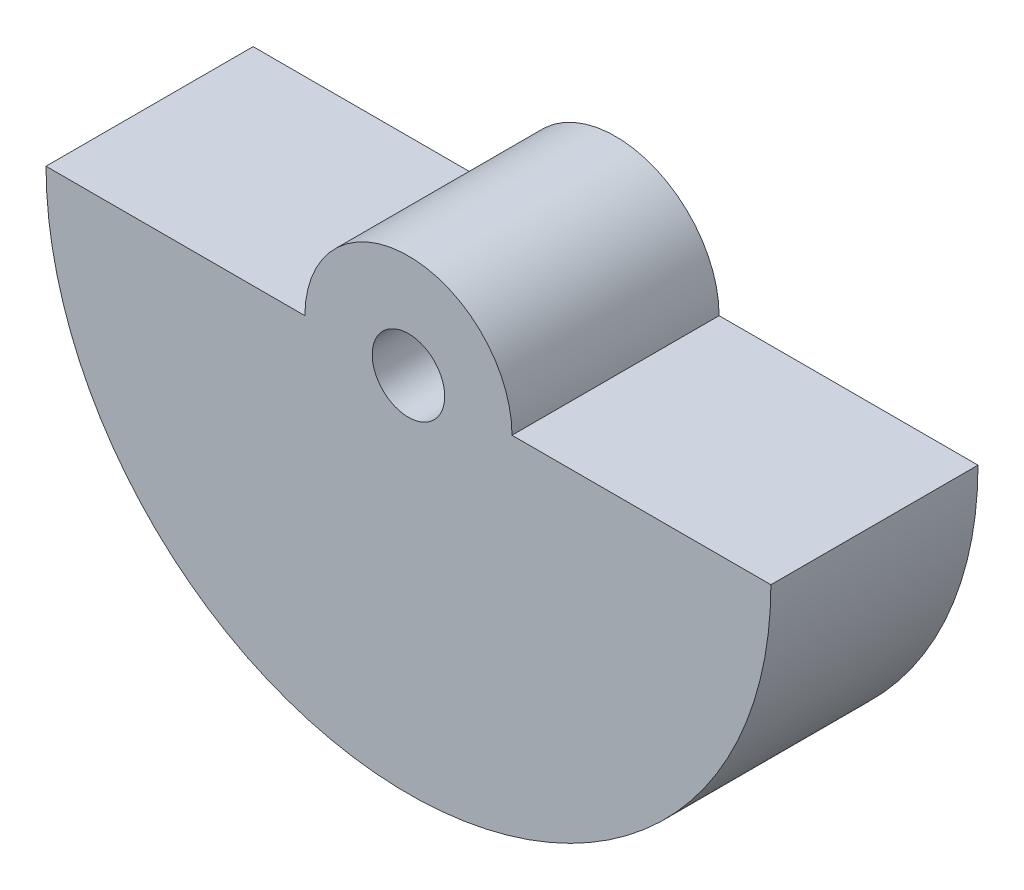
from build123d import *

# Parameters (mm, degrees)
SKETCH1_R           = 3.5
BOSS_EXTRUDE1_DEPTH = 20


with BuildPart() as part:
    # Sketch1 → Boss-Extrude1 (new body)
    with BuildSketch(Plane.XY):
        with BuildLine():
            Line((-35, 0), (-10, 0))
            ThreePointArc((-10, 0), (0, 10), (10, 0))
            Line((10, 0), (35, 0))
            ThreePointArc((35, 0), (0, -35), (-35, 0))
        make_face()
        Circle(SKETCH1_R, mode=Mode.SUBTRACT)
    extrude(amount=BOSS_EXTRUDE1_DEPTH)


solid = part.part
